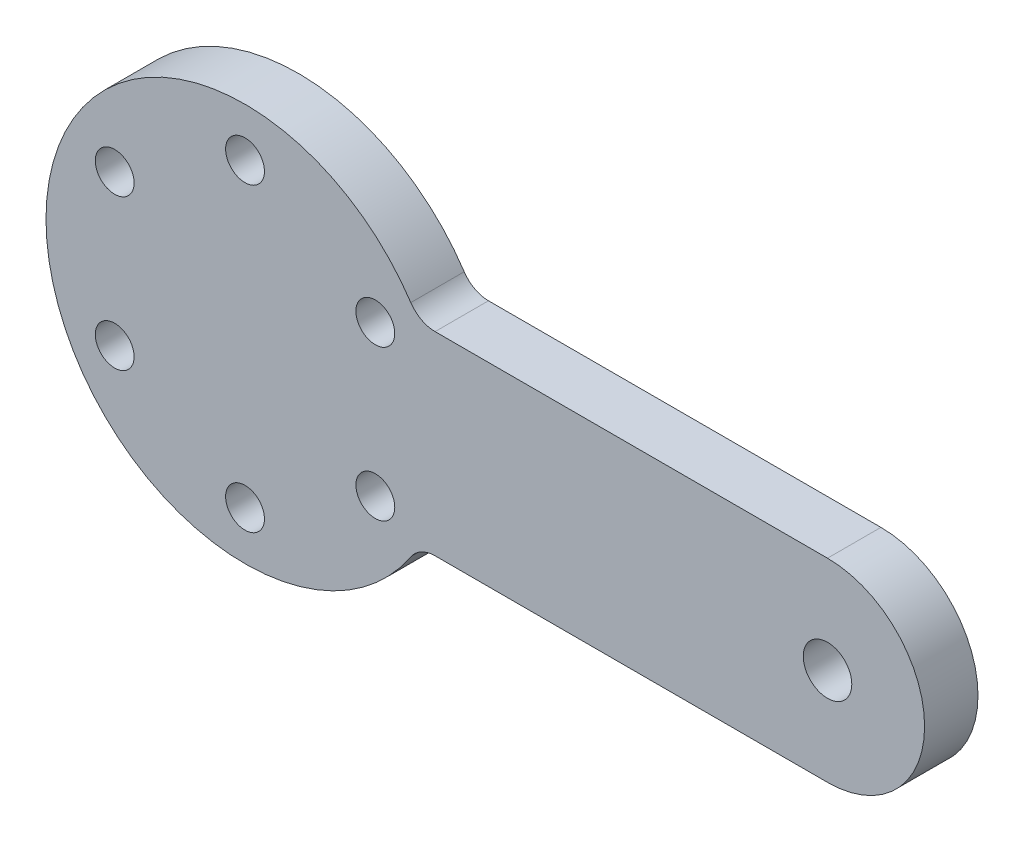
from build123d import *

# Parameters (mm, degrees)
SKETCH_1_R               = 2.5
EXTRUDE_1_DEPTH          = 2.75
CUT_EXTRUDE_1_REACH      = 75.147
SKETCH_2_R               = 2
PATTERN_CIRCULAR_1_COUNT = 6
FILLET_1_R               = 3


with BuildPart() as part:
    # 草圖1 → 填料-伸長1 (new, symmetric)
    with BuildSketch(Plane.XY):
        with BuildLine():
            Line((17.895530168, 10), (60, 10))
            ThreePointArc((60, 10), (70, 0), (60, -10))
            Line((60, -10), (17.895530168, -10))
            ThreePointArc((17.895530168, -10), (-20.5, 0), (17.895530168, 10))
        make_face()
        with Locations((60, 0)):
            Circle(SKETCH_1_R, mode=Mode.SUBTRACT)
    extrude(amount=EXTRUDE_1_DEPTH, both=True)

    # 草圖2 → 除料-伸長1 (cut, up to next)
    with BuildSketch(Plane.XY.offset(2.75), mode=Mode.PRIVATE) as cut_extrude_1_sk1:
        with Locations((0, 15.5)):
            Circle(SKETCH_2_R)
    cut_extrude_1_tool1 = extrude(cut_extrude_1_sk1.sketch, amount=-CUT_EXTRUDE_1_REACH, mode=Mode.PRIVATE) & part.part
    cut_extrude_1 = cut_extrude_1_tool1.solids().sort_by_distance((0, 15.5, 2.75))[0]
    add(cut_extrude_1, mode=Mode.SUBTRACT)

    # 環狀複製排列1: 除料-伸長1 ×6 about axis
    pattern_circular_1_axis = Axis((0, 0, 0), (0, 0, 1))
    for i in range(1, PATTERN_CIRCULAR_1_COUNT):
        add(cut_extrude_1.rotate(pattern_circular_1_axis, i * 360 / PATTERN_CIRCULAR_1_COUNT), mode=Mode.SUBTRACT)

    # 圓角1
    fillet_1_edges = [part.edges().sort_by_distance(p)[0] for p in [
        (17.895530168, 10, 0),
        (17.895530168, -10, 0),
    ]]
    fillet(fillet_1_edges, radius=FILLET_1_R)


solid = part.part
